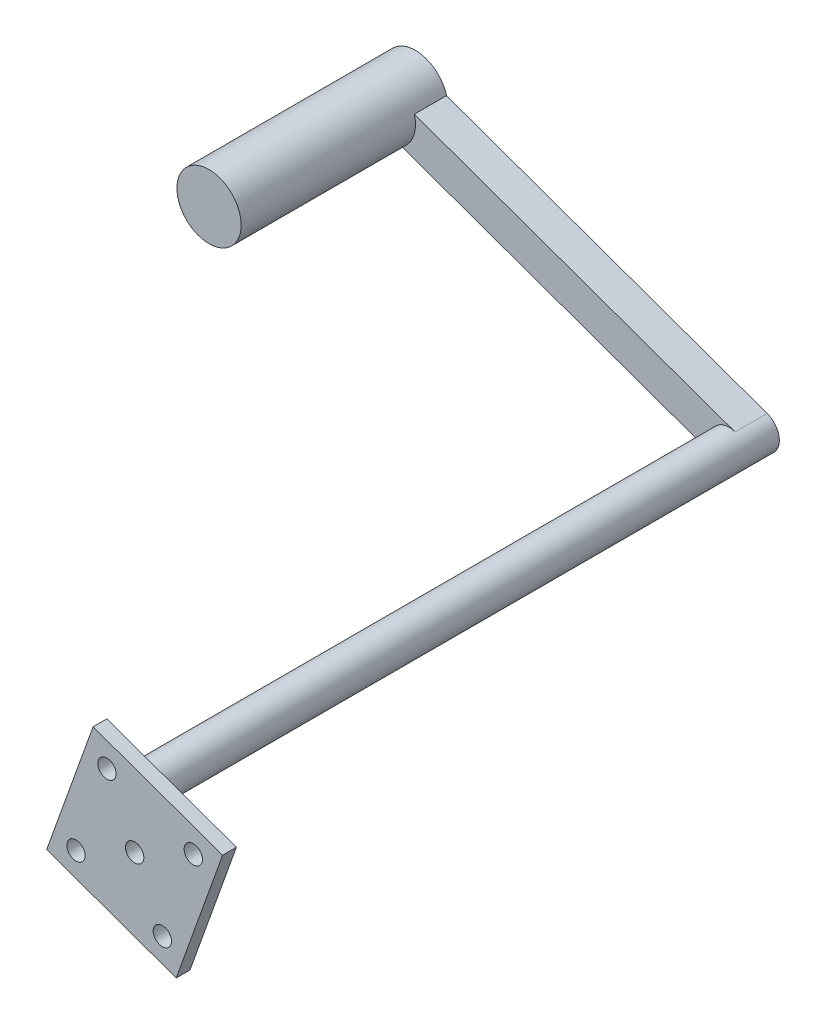
from build123d import *

# Parameters (mm, degrees)
SKETCH_1_R      = 7
EXTRUDE_1_DEPTH = 45
EXTRUDE_2_DEPTH = 7
SKETCH_7_R      = 4
EXTRUDE_3_DEPTH = 135
SKETCH_8_R      = 2
EXTRUDE_4_DEPTH = 3


with BuildPart() as part:
    # 草图1 → 凸台-拉伸1 (new body)
    with BuildSketch(Plane.XY):
        with Locations(Location((-86.606649797, -63.783530386, 0), (0, 0, 180))):
            Circle(SKETCH_1_R)
    extrude(amount=EXTRUDE_1_DEPTH)

    # 草图3 → 凸台-拉伸2 (add)
    with BuildSketch(Plane(origin=(0, 0, 0), x_dir=(-1, 0, 0), z_dir=(0, 0, -1))):
        with BuildLine():
            Line((87.955581339, -67.549215409), (12.641880873, -94.52784625))
            ThreePointArc((12.641880873, -94.52784625), (7.527264308, -92.111092769), (9.944017789, -86.996476204))
            Line((9.944017789, -86.996476204), (85.257718255, -60.017845362))
            ThreePointArc((85.257718255, -60.017845362), (90.37233482, -62.434598843), (87.955581339, -67.549215409))
        make_face()
    extrude(amount=-EXTRUDE_2_DEPTH)

    # 草图7 → 凸台-拉伸3 (add)
    with BuildSketch(Plane.XY.offset(7)):
        with Locations(Location((-11.292949331, -90.762161227, 0), (0, 0, 250.291624105))):
            Circle(SKETCH_7_R)
    extrude(amount=EXTRUDE_3_DEPTH)

    # 草图8 → 凸台-拉伸4 (add)
    with BuildSketch(Plane.XY.offset(142)):
        Polygon((-11.882983583, -74.617445076), (16.359654092, -84.734431642), (6.242667526, -112.977069317), (-21.999970149, -102.860082751), align=None)
        with Locations((-8.862041731, -81.010715783)):
            Circle(SKETCH_8_R, mode=Mode.SUBTRACT)
        with Locations((9.966383385, -87.755373494)):
            Circle(SKETCH_8_R, mode=Mode.SUBTRACT)
        with Locations((-15.606699442, -99.8391409)):
            Circle(SKETCH_8_R, mode=Mode.SUBTRACT)
        with Locations((3.221725675, -106.58379861)):
            Circle(SKETCH_8_R, mode=Mode.SUBTRACT)
        with Locations((-2.820158028, -93.797257197)):
            Circle(SKETCH_8_R, mode=Mode.SUBTRACT)
    extrude(amount=EXTRUDE_4_DEPTH)


solid = part.part
